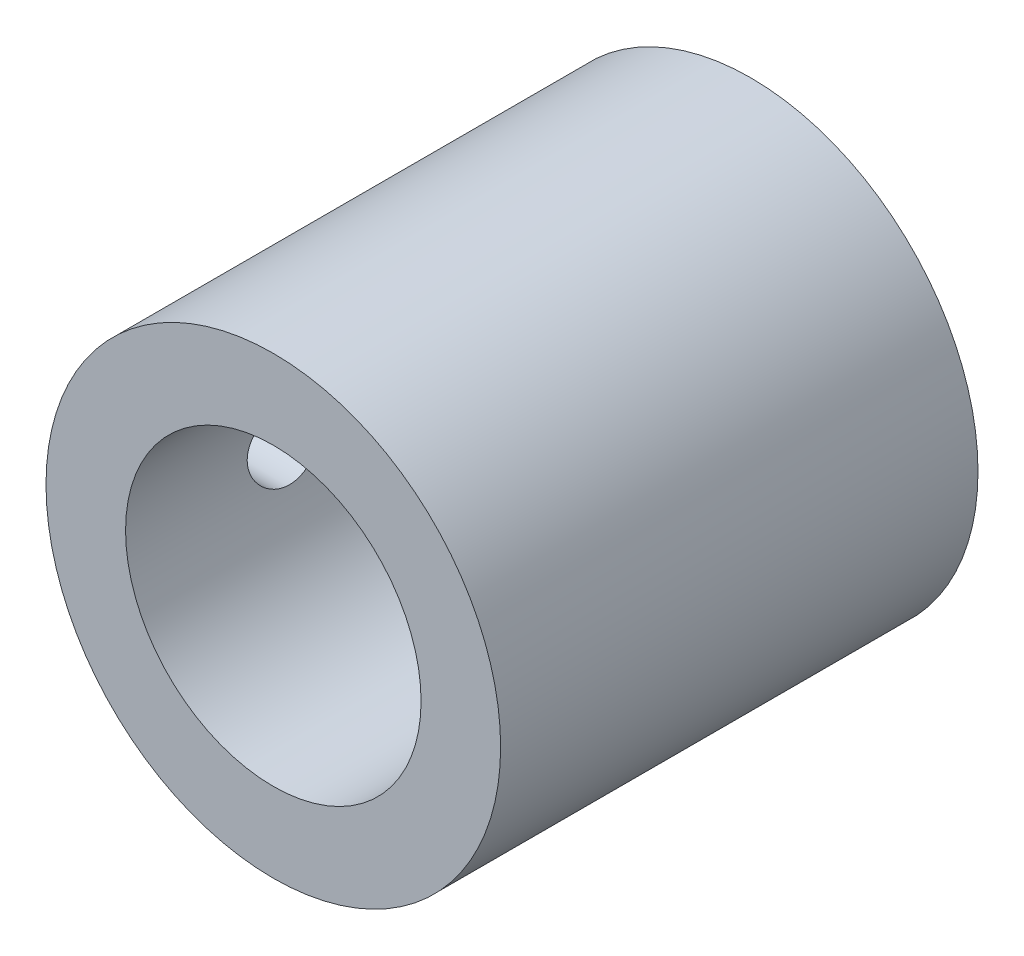
from build123d import *

# Parameters (mm, degrees)
SKETCH_1_R          = 10
EXTRUDE_1_DEPTH     = 21
SKETCH_2_R          = 6.5
CUT_EXTRUDE_1_DEPTH = 15
M4X0_71_D           = 3.3
M4X0_71_DEPTH       = 5
M4X0_71_TIP         = 0.991420021
M3X0_51_D           = 2.5
M3X0_51_DEPTH       = 6


with BuildPart() as part:
    # Эскиз1 → Бобышка-Вытянуть1 (new body)
    with BuildSketch(Plane.XY):
        with Locations(Location((0, 0, 0), (0, 0, 180))):
            Circle(SKETCH_1_R)
    extrude(amount=EXTRUDE_1_DEPTH)

    # Эскиз2 → Вырез-Вытянуть1 (cut)
    with BuildSketch(Plane.XY.offset(21)):
        Circle(SKETCH_2_R)
    extrude(amount=-CUT_EXTRUDE_1_DEPTH, mode=Mode.SUBTRACT)

    # Отверстие обработанное метчиком M4x0.71
    with Locations(Plane(origin=(-10, 0, 0), x_dir=(0, 0, -1), z_dir=(-1, 0, 0))):
        with Locations((-14, 0)):
            Hole(M4X0_71_D / 2, depth=M4X0_71_DEPTH)
            with Locations((0, 0, -(M4X0_71_DEPTH + M4X0_71_TIP / 2))):  # 118° drill point
                Cone(0, M4X0_71_D / 2, M4X0_71_TIP, mode=Mode.SUBTRACT)

    # Отверстие обработанное метчиком M3x0.51
    with Locations(Plane(origin=(0, 0, 0), x_dir=(-1, 0, 0), z_dir=(0, 0, -1))):
        with Locations((-4.242640687, 4.242640687), (4.242640687, 4.242640687), (4.242640687, -4.242640687), (-4.242640687, -4.242640687)):
            Hole(M3X0_51_D / 2, depth=M3X0_51_DEPTH)


solid = part.part
